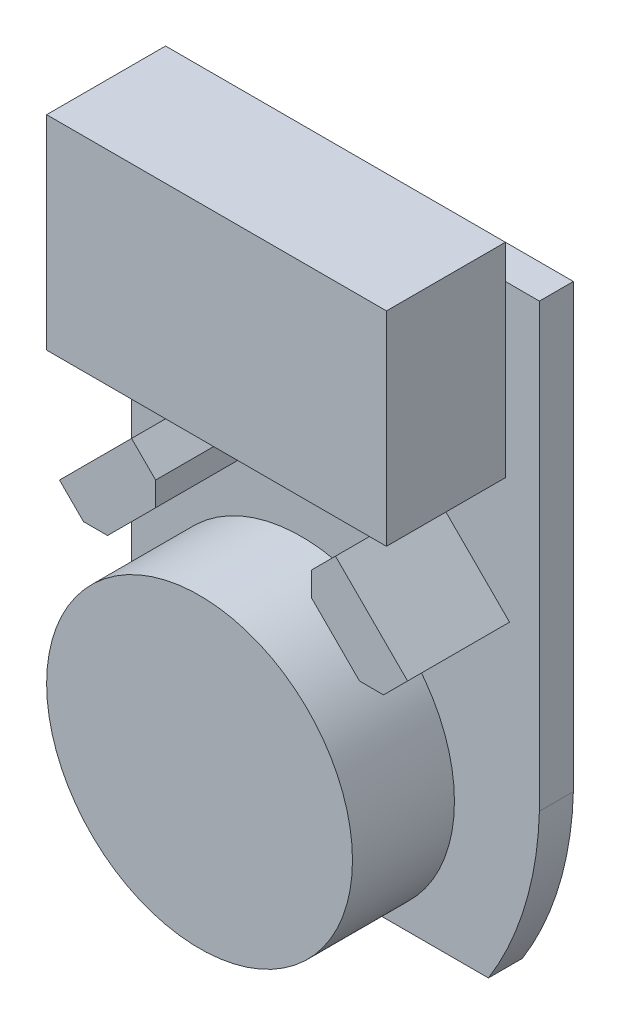
from build123d import *

# Parameters (mm, degrees)
BOSS_EXTRU_1_DEPTH = 1
BOSS_EXTRU_2_START = 1
BOSS_EXTRU_2_DEPTH = 1
BOSS_EXTRU_3_START = 2
BOSS_EXTRU_3_DEPTH = 3
BOSS_EXTRU_4_START = 1
ESQUISSE1_6_W      = 10
ESQUISSE1_6_H      = 6
BOSS_EXTRU_4_DEPTH = 3.5
BOSS_EXTRU_5_DEPTH = 3


with BuildPart() as part:
    # Esquisse1 → Boss.-Extru.1 (new body)
    with BuildSketch(Plane.XY):
        with BuildLine():
            Line((-6, 0), (-6, 13))
            Line((-6, 13), (6, 13))
            Line((6, 13), (6, 0))
            ThreePointArc((6, 0), (5.582013923, -2.599604177), (4.5, -5))
            Line((4.5, -5), (-4.5, -5))
            ThreePointArc((-4.5, -5), (-5.582013923, -2.599604177), (-6, 0))
        make_face()
    extrude(amount=BOSS_EXTRU_1_DEPTH)

    # Esquisse1<4> → Boss.-Extru.2 (add)
    with BuildSketch(Plane.XY.offset(BOSS_EXTRU_2_START)):
        with BuildLine():
            ThreePointArc((0, 0.5), (-0.5, 0), (0, -0.5))
            Line((0, -0.5), (0, 0.5))
        make_face()
        with BuildLine():
            Line((0, 0.5), (0, -0.5))
            ThreePointArc((0, -0.5), (0.353553391, -0.353553391), (0.5, 0))
            ThreePointArc((0.5, 0), (0.353553391, 0.353553391), (0, 0.5))
        make_face()
    extrude(amount=BOSS_EXTRU_2_DEPTH)

    # Esquisse1<5> → Boss.-Extru.3 (add)
    with BuildSketch(Plane.XY.offset(BOSS_EXTRU_3_START)):
        with BuildLine():
            ThreePointArc((0, 4.5), (-4.5, 0), (0, -4.5))
            Line((0, -4.5), (0, -0.5))
            ThreePointArc((0, -0.5), (-0.5, 0), (0, 0.5))
            Line((0, 0.5), (0, 4.5))
        make_face()
        with BuildLine():
            Line((0, -0.5), (0, -4.5))
            ThreePointArc((0, -4.5), (3.181980515, -3.181980515), (4.5, 0))
            ThreePointArc((4.5, 0), (3.181980515, 3.181980515), (0, 4.5))
            Line((0, 4.5), (0, 0.5))
            ThreePointArc((0, 0.5), (0.353553391, 0.353553391), (0.5, 0))
            ThreePointArc((0.5, 0), (0.353553391, -0.353553391), (0, -0.5))
        make_face()
        with BuildLine():
            ThreePointArc((0, 0.5), (-0.5, 0), (0, -0.5))
            Line((0, -0.5), (0, 0.5))
        make_face()
        with BuildLine():
            Line((0, 0.5), (0, -0.5))
            ThreePointArc((0, -0.5), (0.353553391, -0.353553391), (0.5, 0))
            ThreePointArc((0.5, 0), (0.353553391, 0.353553391), (0, 0.5))
        make_face()
    extrude(amount=BOSS_EXTRU_3_DEPTH)

    # Esquisse1<6> → Boss.-Extru.4 (add)
    with BuildSketch(Plane.XY.offset(BOSS_EXTRU_4_START)):
        with Locations((0, 11)):
            Rectangle(ESQUISSE1_6_W, ESQUISSE1_6_H)
    extrude(amount=BOSS_EXTRU_4_DEPTH)

    # Esquisse2 → Boss.-Extru.5 (add)
    with BuildSketch(Plane.XY.offset(1)):
        Polygon((-5.121320344, 4.378679656), (-3, 6.5), (-2.292893219, 5.792893219), (-2.292893219, 5.085786438), (-3.707106781, 3.671572875), (-4.414213562, 3.671572875), align=None)
    boss_extru_5 = extrude(amount=BOSS_EXTRU_5_DEPTH)

    # Symétrie1: Boss.-Extru.5 across plane
    add(boss_extru_5.mirror(Plane(origin=(0, 0, 0), x_dir=(0, 0, 1), z_dir=(1, 0, 0))))


solid = part.part
